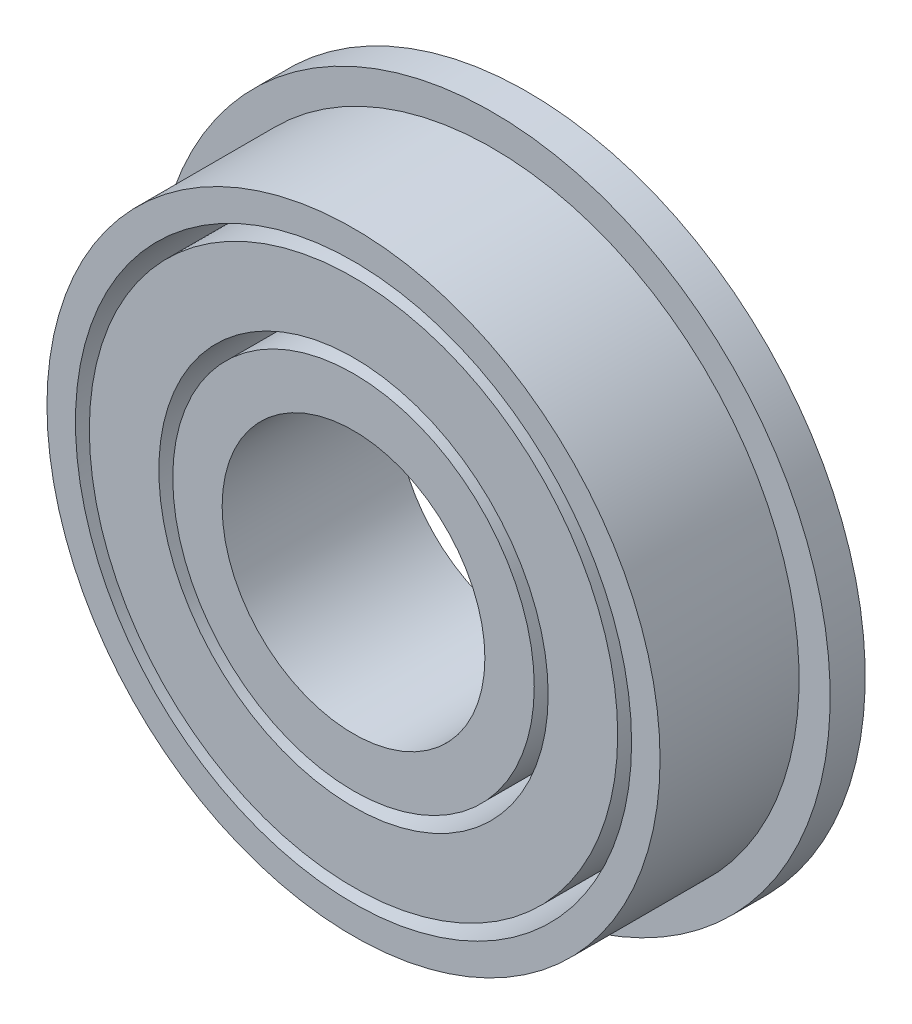
from build123d import *

# Parameters (mm, degrees)
CROQUIS1_R              = 14
CROQUIS1_R_2            = 6
SALIENTE_EXTRUIR1_DEPTH = 7.9502
CROQUIS2_R              = 15.42
CROQUIS2_R_2            = 14
SALIENTE_EXTRUIR2_DEPTH = 1.6002
CROQUIS3_R              = 12.7
CROQUIS3_R_2            = 12.065
CROQUIS3_R_3            = 8.89
CROQUIS3_R_4            = 8.255
CORTAR_EXTRUIR1_DEPTH   = 25.4


with BuildPart() as part:
    # Croquis1 → Saliente-Extruir1 (new body)
    with BuildSketch(Plane.XY):
        Circle(CROQUIS1_R)
        Circle(CROQUIS1_R_2, mode=Mode.SUBTRACT)
    extrude(amount=SALIENTE_EXTRUIR1_DEPTH)

    # Croquis2 → Saliente-Extruir2 (add)
    with BuildSketch(Plane(origin=(0, 0, 0), x_dir=(-1, 0, 0), z_dir=(0, 0, -1))):
        Circle(CROQUIS2_R)
        Circle(CROQUIS2_R_2, mode=Mode.SUBTRACT)
    extrude(amount=-SALIENTE_EXTRUIR2_DEPTH)

    # Croquis3 → Cortar-Extruir1 (cut)
    # profile 1 of 2: a face of its own
    with BuildSketch(Plane.XY.offset(7.9502)):
        Circle(CROQUIS3_R)
        Circle(CROQUIS3_R_2, mode=Mode.SUBTRACT)
    # profile 2 of 2: a face of its own
    with BuildSketch(Plane.XY.offset(7.9502)):
        Circle(CROQUIS3_R_3)
        Circle(CROQUIS3_R_4, mode=Mode.SUBTRACT)
    extrude(amount=-CORTAR_EXTRUIR1_DEPTH, mode=Mode.SUBTRACT)


with BuildPart() as cortar_extruir1_piece_1:
    # of the separate pieces the step leaves, piece 1, a body of its own (cortar_extruir1_pieces)
    add(part.part.solids().sort_by_distance((12.065, 0, 7.9502))[0])


with BuildPart() as cortar_extruir1_piece_2:
    # of the separate pieces the step leaves, piece 2, a body of its own (cortar_extruir1_pieces)
    add(part.part.solids().sort_by_distance((14, 0, 1.6002))[0])


with BuildPart() as cortar_extruir1_piece_3:
    # of the separate pieces the step leaves, piece 3, a body of its own (cortar_extruir1_pieces)
    add(part.part.solids().sort_by_distance((8.255, 0, 7.9502))[0])


solid = Compound([cortar_extruir1_piece_1.part, cortar_extruir1_piece_2.part, cortar_extruir1_piece_3.part])
